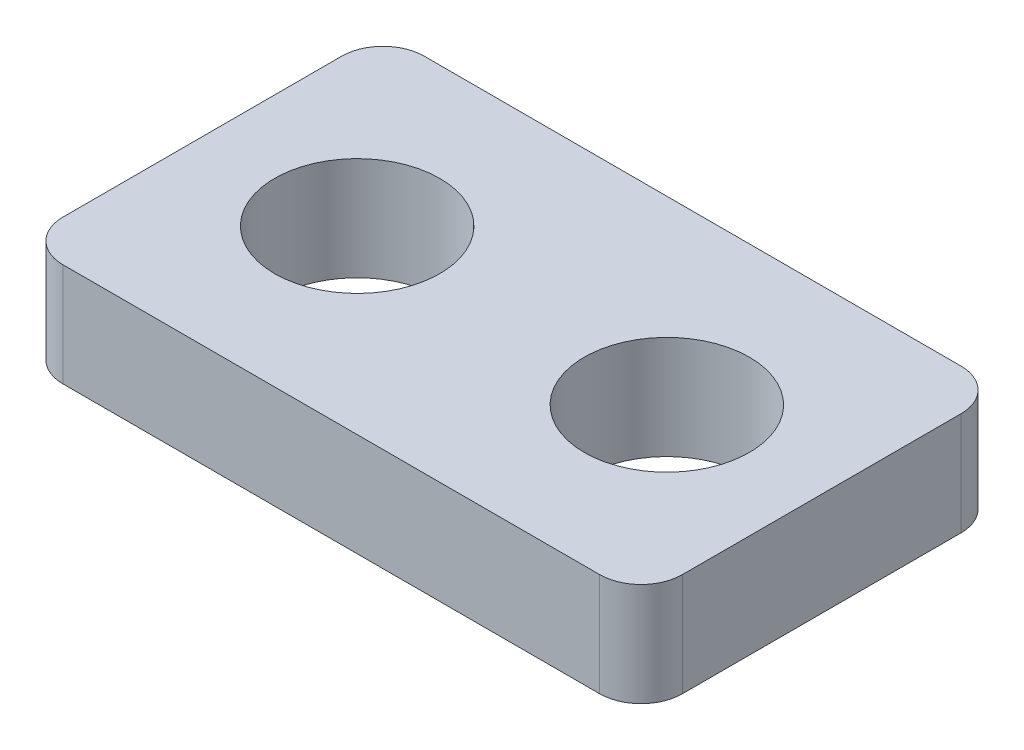
from build123d import *

# Parameters (mm, degrees)
SKETCH1_W           = 12
SKETCH1_H           = 7
BOSS_EXTRUDE1_DEPTH = 2
SKETCH2_R           = 1.6
CUT_EXTRUDE1_DEPTH  = 8.228416147
FILLET1_R           = 0.8


with BuildPart() as part:
    # Sketch1 → Boss-Extrude1 (new body)
    with BuildSketch(Plane(origin=(0, 0, 0), x_dir=(1, 0, 0), z_dir=(0, 1, 0))):
        Rectangle(SKETCH1_W, SKETCH1_H)
    extrude(amount=BOSS_EXTRUDE1_DEPTH)

    # Sketch2 → Cut-Extrude1 (cut, through all)
    with BuildSketch(Plane(origin=(0, 2, 0), x_dir=(1, 0, 0), z_dir=(0, 1, 0))):
        with Locations(Location((-3, 0, 0), (0, 0, 270))):
            Circle(SKETCH2_R)
        with Locations(Location((3, 0, 0), (0, 0, 270))):
            Circle(SKETCH2_R)
    extrude(amount=-CUT_EXTRUDE1_DEPTH, mode=Mode.SUBTRACT)

    # Fillet1
    fillet1_edges = [part.edges().sort_by_distance(p)[0] for p in [
        (6, 1, 3.5),
        (-6, 1, 3.5),
        (-6, 1, -3.5),
        (6, 1, -3.5),
    ]]
    fillet(fillet1_edges, radius=FILLET1_R)


solid = part.part
